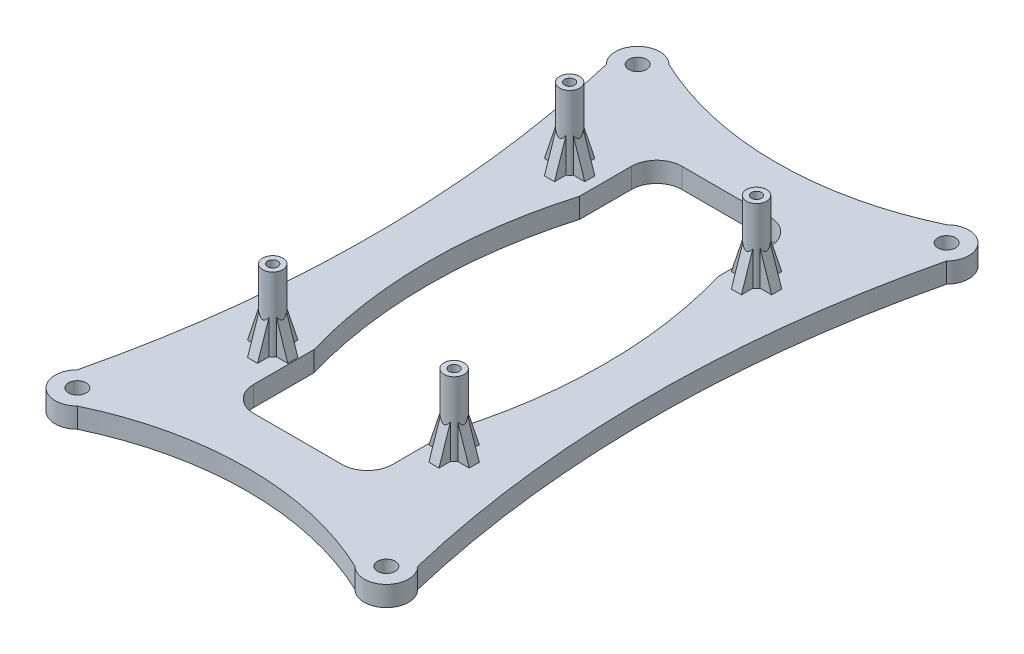
from build123d import *

# Parameters (mm, degrees)
SKETCH2_R           = 2.2225
BOSS_EXTRUDE1_DEPTH = 5.08
SKETCH3_R           = 2.54
BOSS_EXTRUDE2_DEPTH = 18.542
CUT_EXTRUDE3_DEPTH  = 115.306625788
BOSS_EXTRUDE4_DEPTH = 1.27
BOSS_EXTRUDE5_DEPTH = 1.27
BOSS_EXTRUDE6_DEPTH = 1.27
CIRPATTERN2_COUNT   = 4
CIRPATTERN3_COUNT   = 4
CIRPATTERN4_COUNT   = 4
BOSS_EXTRUDE7_DEPTH = 1.27
CIRPATTERN5_COUNT   = 4
SKETCH4_R           = 1.27
CUT_EXTRUDE1_DEPTH  = 116.239740624
SKETCH15_R          = 2.3495
CUT_EXTRUDE4_DEPTH  = 2.54


with BuildPart() as part:
    # Sketch2 → Boss-Extrude1 (new body)
    with BuildSketch(Plane(origin=(0, 0, 0), x_dir=(1, 0, 0), z_dir=(0, 1, 0))):
        with BuildLine():
            ThreePointArc((-4.452387578, 66.61453395), (-12.35501214, 66.614531476), (-12.355011316, 58.711906914))
            ThreePointArc((-12.355011316, 58.711906914), (-4.452390572, -7.958097729), (-12.355011316, -74.628102372))
            ThreePointArc((-12.355011316, -74.628102372), (-12.35501214, -82.530726934), (-4.452387578, -82.530729408))
            ThreePointArc((-4.452387578, -82.530729408), (30.547609428, -74.628097729), (65.547606434, -82.530729408))
            ThreePointArc((65.547606434, -82.530729408), (73.450230996, -82.530726934), (73.450230171, -74.628102372))
            ThreePointArc((73.450230171, -74.628102372), (65.547609428, -7.958097729), (73.450230171, 58.711906914))
            ThreePointArc((73.450230171, 58.711906914), (73.450230996, 66.614531476), (65.547606434, 66.61453395))
            ThreePointArc((65.547606434, 66.61453395), (30.547609428, 58.711902271), (-4.452387578, 66.61453395))
        make_face()
        with Locations((-8.403698623, 62.663219607)):
            Circle(SKETCH2_R, mode=Mode.SUBTRACT)
        with BuildLine():
            Line((13.047609428, -55.578097729), (13.047609428, 33.309286171))
            Line((13.047609428, 33.309286171), (13.047609428, 39.661902271))
            ThreePointArc((13.047609428, 39.661902271), (14.907481367, 44.152030332), (19.397609428, 46.011902271))
            Line((19.397609428, 46.011902271), (41.697609428, 46.011902271))
            ThreePointArc((41.697609428, 46.011902271), (46.187737488, 44.152030332), (48.047609428, 39.661902271))
            Line((48.047609428, 39.661902271), (48.047609428, -55.578097729))
            ThreePointArc((48.047609428, -55.578097729), (46.187737488, -60.068225789), (41.697609428, -61.928097729))
            Line((41.697609428, -61.928097729), (19.397609428, -61.928097729))
            ThreePointArc((19.397609428, -61.928097729), (14.907481367, -60.068225789), (13.047609428, -55.578097729))
        make_face(mode=Mode.SUBTRACT)
        with Locations((69.498917478, 62.663219607)):
            Circle(SKETCH2_R, mode=Mode.SUBTRACT)
        with Locations((69.498917478, -78.579415065)):
            Circle(SKETCH2_R, mode=Mode.SUBTRACT)
        with Locations((-8.403698623, -78.579415065)):
            Circle(SKETCH2_R, mode=Mode.SUBTRACT)
    extrude(amount=BOSS_EXTRUDE1_DEPTH)

    # Sketch3 → Boss-Extrude2 (add)
    with BuildSketch(Plane(origin=(0, 5.08, 0), x_dir=(1, 0, 0), z_dir=(0, 1, 0))):
        with Locations((7.687609428, -45.418097729)):
            Circle(SKETCH3_R)
        with Locations((53.407609428, -45.418097729)):
            Circle(SKETCH3_R)
        with Locations((5.453609428, 31.660902271)):
            Circle(SKETCH3_R)
        with Locations((53.713609428, 30.517902271)):
            Circle(SKETCH3_R)
    extrude(amount=BOSS_EXTRUDE2_DEPTH)

    # Sketch6 → Cut-Extrude3 (cut, through all)
    with BuildSketch(Plane(origin=(0, 5.08, 0), x_dir=(1, 0, 0), z_dir=(0, 1, 0))):
        with BuildLine():
            Line((13.047609428, 26.580902271), (13.047609428, -40.338097729))
            ThreePointArc((13.047609428, -40.338097729), (8.247609428, -6.878597729), (13.047609428, 26.580902271))
        make_face()
        with BuildLine():
            Line((48.047609428, 26.580902271), (48.047609428, -40.338097729))
            ThreePointArc((48.047609428, -40.338097729), (52.847609428, -6.878597729), (48.047609428, 26.580902271))
        make_face()
    extrude(amount=-CUT_EXTRUDE3_DEPTH, mode=Mode.SUBTRACT)

    # Sketch11 → Boss-Extrude4 (add, symmetric)
    with BuildSketch(Plane.ZY.offset(-53.713609428)):
        Polygon((-30.517902271, 5.08), (-25.437902271, 5.08), (-30.517902271, 20.32), align=None)
    boss_extrude4 = extrude(amount=BOSS_EXTRUDE4_DEPTH, both=True)

    # Sketch12 → Boss-Extrude5 (add, symmetric)
    with BuildSketch(Plane.ZY.offset(-53.407609428)):
        Polygon((45.418097729, 20.32), (45.418097729, 5.08), (50.498097729, 5.08), align=None)
    boss_extrude5 = extrude(amount=BOSS_EXTRUDE5_DEPTH, both=True)

    # Sketch13 → Boss-Extrude6 (add, symmetric)
    with BuildSketch(Plane.ZY.offset(-7.687609428)):
        Polygon((45.418097729, 5.08), (50.498097729, 5.08), (45.418097729, 20.32), align=None)
    boss_extrude6 = extrude(amount=BOSS_EXTRUDE6_DEPTH, both=True)

    # CirPattern2: Boss-Extrude4 ×4 about axis
    cirpattern2_axis = Axis((53.713609428, 23.622, -30.517902271), (0, 1, 0))
    for i in range(1, CIRPATTERN2_COUNT):
        add(boss_extrude4.rotate(cirpattern2_axis, i * 360 / CIRPATTERN2_COUNT))

    # CirPattern3: Boss-Extrude5 ×4 about axis
    cirpattern3_axis = Axis((53.407609428, 23.622, 45.418097729), (0, 1, 0))
    for i in range(1, CIRPATTERN3_COUNT):
        add(boss_extrude5.rotate(cirpattern3_axis, i * 360 / CIRPATTERN3_COUNT))

    # CirPattern4: Boss-Extrude6 ×4 about axis
    cirpattern4_axis = Axis((7.687609428, 23.622, 45.418097729), (0, 1, 0))
    for i in range(1, CIRPATTERN4_COUNT):
        add(boss_extrude6.rotate(cirpattern4_axis, i * 360 / CIRPATTERN4_COUNT))

    # Sketch14 → Boss-Extrude7 (add, symmetric)
    with BuildSketch(Plane.ZY.offset(-5.453609428)):
        Polygon((-31.660902271, 20.32), (-26.580902271, 5.08), (-31.660902271, 5.08), align=None)
    boss_extrude7 = extrude(amount=BOSS_EXTRUDE7_DEPTH, both=True)

    # CirPattern5: Boss-Extrude7 ×4 about axis
    cirpattern5_axis = Axis((5.453609428, 23.622, -31.660902271), (0, 1, 0))
    for i in range(1, CIRPATTERN5_COUNT):
        add(boss_extrude7.rotate(cirpattern5_axis, i * 360 / CIRPATTERN5_COUNT))

    # Sketch4 → Cut-Extrude1 (cut, through all)
    with BuildSketch(Plane(origin=(0, 23.622, 0), x_dir=(1, 0, 0), z_dir=(0, 1, 0))):
        with Locations((5.453609428, 31.660902271)):
            Circle(SKETCH4_R)
        with Locations((53.713609428, 30.517902271)):
            Circle(SKETCH4_R)
        with Locations((53.407609428, -45.418097729)):
            Circle(SKETCH4_R)
        with Locations((7.687609428, -45.418097729)):
            Circle(SKETCH4_R)
    extrude(amount=-CUT_EXTRUDE1_DEPTH, mode=Mode.SUBTRACT)

    # Sketch15 → Cut-Extrude4 (cut)
    with BuildSketch(Plane.XZ):
        with Locations((53.713609428, -30.517902271)):
            Circle(SKETCH15_R)
        with Locations((5.453609428, -31.660902271)):
            Circle(SKETCH15_R)
        with Locations((7.687609428, 45.418097729)):
            Circle(SKETCH15_R)
        with Locations((53.407609428, 45.418097729)):
            Circle(SKETCH15_R)
    extrude(amount=-CUT_EXTRUDE4_DEPTH, mode=Mode.SUBTRACT)


solid = part.part
